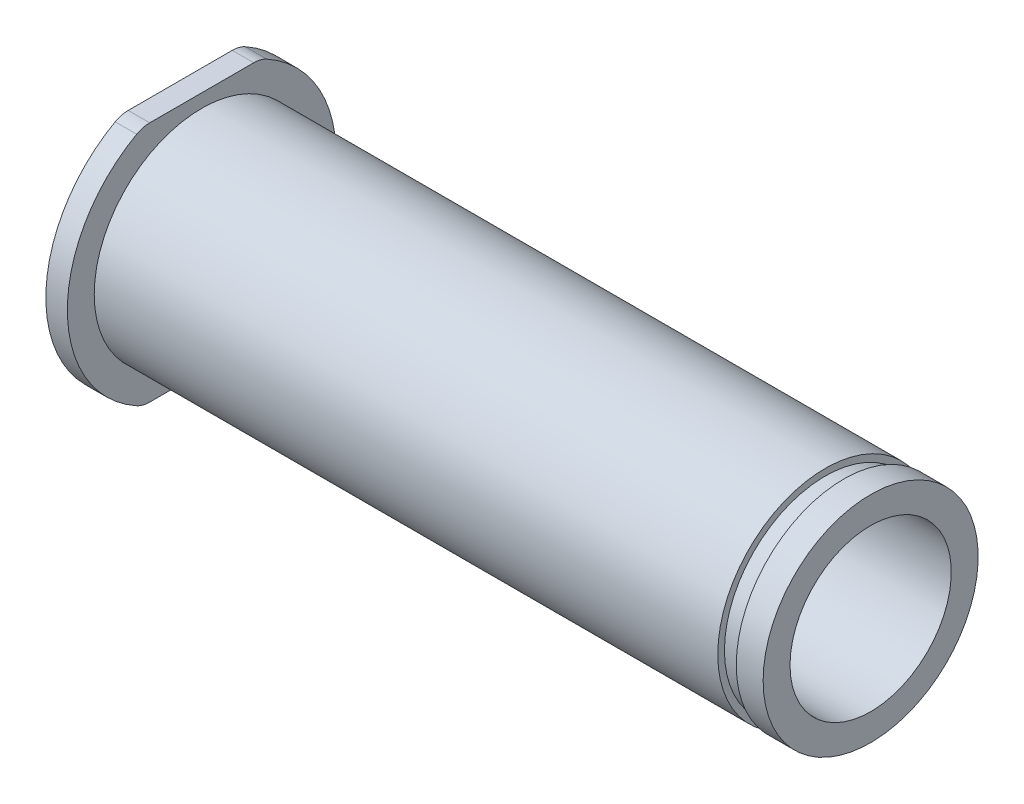
from build123d import *

# Parameters (mm, degrees)
CUT_EXTRUDE1_REACH = 86.593
SKETCH2_W          = 13.839504146
SKETCH2_H          = 1.5875
FILLET1_R          = 3.175


with BuildPart() as part:
    # Sketch1 → Revolve1 (revolve)
    with BuildSketch(Plane.XY, mode=Mode.PRIVATE) as revolve1_sk:
        Polygon((0, 9.525), (81.5594, 9.525), (81.5594, 12.7), (78.3844, 12.7), (78.3844, 11.9126), (76.2, 11.9126), (76.2, 12.7), (2.54, 12.7), (2.54, 15.875), (0, 15.875), align=None)
    revolve(revolve1_sk.sketch.rotate(Axis((0, 0, 0), (1, 0, 0)), 90), axis=Axis((0, 0, 0), (1, 0, 0)))

    # Sketch2 → Cut-Extrude1 (cut, up to next)
    with BuildSketch(Plane.ZY, mode=Mode.PRIVATE) as cut_extrude1_sk1:
        with Locations((0, 15.08125)):
            Rectangle(SKETCH2_W, SKETCH2_H)
    cut_extrude1_tool1 = extrude(cut_extrude1_sk1.sketch, amount=-CUT_EXTRUDE1_REACH, mode=Mode.PRIVATE) & part.part
    # Sketch2 → Cut-Extrude1 (cut, up to next)
    with BuildSketch(Plane.ZY, mode=Mode.PRIVATE) as cut_extrude1_sk2:
        with Locations((0, -15.08125)):
            Rectangle(SKETCH2_W, SKETCH2_H)
    cut_extrude1_tool2 = extrude(cut_extrude1_sk2.sketch, amount=-CUT_EXTRUDE1_REACH, mode=Mode.PRIVATE) & part.part
    add(cut_extrude1_tool1.solids().sort_by_distance((0, 15.08125, 0))[0], mode=Mode.SUBTRACT)
    add(cut_extrude1_tool2.solids().sort_by_distance((0, -15.08125, 0))[0], mode=Mode.SUBTRACT)

    # Fillet1
    fillet1_edges = [part.edges().sort_by_distance(p)[0] for p in [
        (1.27, 14.2875, -6.919752073),
        (1.27, 14.2875, 6.919752073),
        (1.27, -14.2875, -6.919752073),
        (1.27, -14.2875, 6.919752073),
    ]]
    fillet(fillet1_edges, radius=FILLET1_R)


solid = part.part
